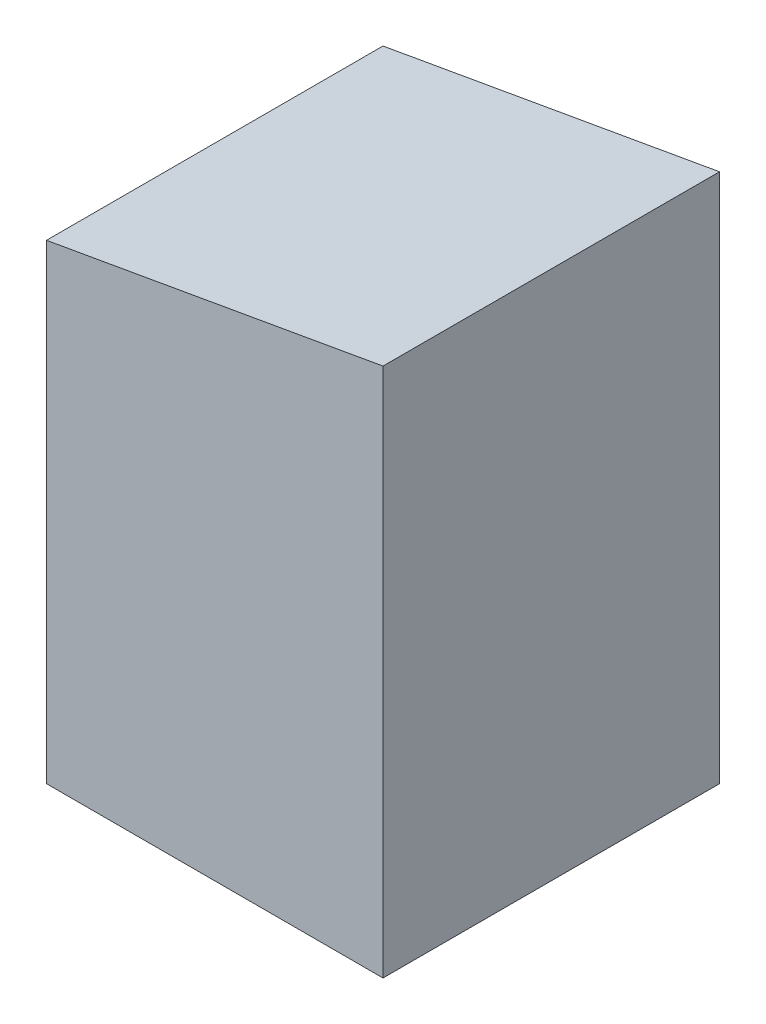
from build123d import *

# Parameters (mm, degrees)
SKETCH1_W           = 88.9
SKETCH1_H           = 88.9
BOSS_EXTRUDE1_DEPTH = 140
CUT_EXTRUDE1_DEPTH  = 135


with BuildPart() as part:
    # Sketch1 → Boss-Extrude1 (new body)
    with BuildSketch(Plane(origin=(0, 0, 0), x_dir=(1, 0, 0), z_dir=(0, 1, 0))):
        Rectangle(SKETCH1_W, SKETCH1_H)
    extrude(amount=BOSS_EXTRUDE1_DEPTH)

    # Sketch2 → Cut-Extrude1 (cut)
    with BuildSketch(Plane.XY.offset(44.45)):
        Polygon((44.45, 140), (-44.45, 124.324531415), (-44.45, 140), align=None)
    extrude(amount=-CUT_EXTRUDE1_DEPTH, mode=Mode.SUBTRACT)


solid = part.part
